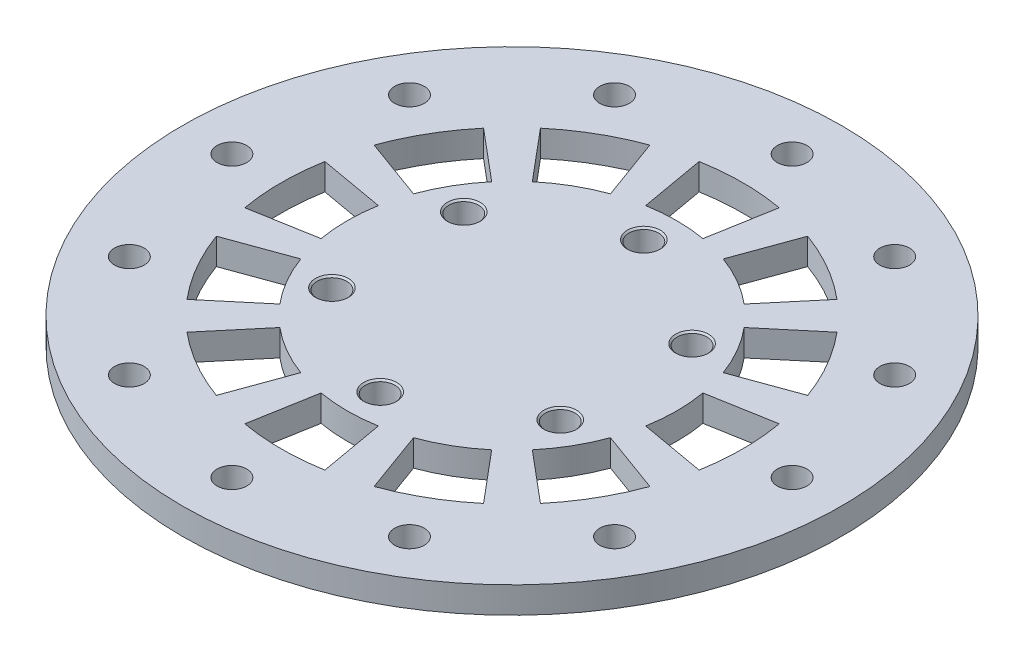
from build123d import *

# Parameters (mm, degrees)
SKETCH_1_R                  = 50
EXTRUDE_1_DEPTH             = 4
CUT_EXTRUDE_2_DEPTH         = 71.823724839
HOLE_WIZARD_M41_D           = 4.5
HOLE_WIZARD_M41_CSINK_D     = 5
HOLE_WIZARD_M41_CSINK_ANGLE = 90
HOLE_WIZARD_M42_D           = 4.5
HOLE_WIZARD_M42_CSINK_D     = 5
HOLE_WIZARD_M42_CSINK_ANGLE = 90


with BuildPart() as part:
    # Эскиз1 → Бобышка-Вытянуть1 (new body)
    with BuildSketch(Plane(origin=(0, 0, 0), x_dir=(1, 0, 0), z_dir=(0, 1, 0))):
        with Locations(Location((0, 0, 0), (0, 0, 270))):
            Circle(SKETCH_1_R)
    extrude(amount=EXTRUDE_1_DEPTH)

    # Эскиз2 → Вырез-Вытянуть2 (cut, through all)
    with BuildSketch(Plane(origin=(0, 0, 0), x_dir=(1, 0, 0), z_dir=(0, 1, 0))):
        with BuildLine():
            Line((8.550503583, -23.49231552), (11.970705016, -32.889241728))
            ThreePointArc((11.970705016, -32.889241728), (17.5, -30.310889132), (22.497566339, -26.811555509))
            Line((22.497566339, -26.811555509), (16.069690242, -19.151111078))
            ThreePointArc((16.069690242, -19.151111078), (12.5, -21.650635095), (8.550503583, -23.49231552))
        make_face()
        with BuildLine():
            Line((-4.341204442, -24.620193825), (-6.077686218, -34.468271355))
            ThreePointArc((-6.077686218, -34.468271355), (0, -35), (6.077686218, -34.468271355))
            Line((6.077686218, -34.468271355), (4.341204442, -24.620193825))
            ThreePointArc((4.341204442, -24.620193825), (0, -25), (-4.341204442, -24.620193825))
        make_face()
        with BuildLine():
            Line((23.49231552, 8.550503583), (32.889241728, 11.970705016))
            ThreePointArc((32.889241728, 11.970705016), (30.310889132, 17.5), (26.811555509, 22.497566339))
            Line((26.811555509, 22.497566339), (19.151111078, 16.069690242))
            ThreePointArc((19.151111078, 16.069690242), (21.650635095, 12.5), (23.49231552, 8.550503583))
        make_face()
        with BuildLine():
            Line((24.620193825, -4.341204442), (34.468271355, -6.077686218))
            ThreePointArc((34.468271355, -6.077686218), (35, 0), (34.468271355, 6.077686218))
            Line((34.468271355, 6.077686218), (24.620193825, 4.341204442))
            ThreePointArc((24.620193825, 4.341204442), (25, 0), (24.620193825, -4.341204442))
        make_face()
        with BuildLine():
            Line((19.151111078, -16.069690242), (26.811555509, -22.497566339))
            ThreePointArc((26.811555509, -22.497566339), (30.310889132, -17.5), (32.889241728, -11.970705016))
            Line((32.889241728, -11.970705016), (23.49231552, -8.550503583))
            ThreePointArc((23.49231552, -8.550503583), (21.650635095, -12.5), (19.151111078, -16.069690242))
        make_face()
        with BuildLine():
            Line((-8.550503583, 23.49231552), (-11.970705016, 32.889241728))
            ThreePointArc((-11.970705016, 32.889241728), (-17.5, 30.310889132), (-22.497566339, 26.811555509))
            Line((-22.497566339, 26.811555509), (-16.069690242, 19.151111078))
            ThreePointArc((-16.069690242, 19.151111078), (-12.5, 21.650635095), (-8.550503583, 23.49231552))
        make_face()
        with BuildLine():
            Line((4.341204442, 24.620193825), (6.077686218, 34.468271355))
            ThreePointArc((6.077686218, 34.468271355), (0, 35), (-6.077686218, 34.468271355))
            Line((-6.077686218, 34.468271355), (-4.341204442, 24.620193825))
            ThreePointArc((-4.341204442, 24.620193825), (0, 25), (4.341204442, 24.620193825))
        make_face()
        with BuildLine():
            Line((16.069690242, 19.151111078), (22.497566339, 26.811555509))
            ThreePointArc((22.497566339, 26.811555509), (17.5, 30.310889132), (11.970705016, 32.889241728))
            Line((11.970705016, 32.889241728), (8.550503583, 23.49231552))
            ThreePointArc((8.550503583, 23.49231552), (12.5, 21.650635095), (16.069690242, 19.151111078))
        make_face()
        with BuildLine():
            Line((-16.069690242, -19.151111078), (-22.497566339, -26.811555509))
            ThreePointArc((-22.497566339, -26.811555509), (-17.5, -30.310889132), (-11.970705016, -32.889241728))
            Line((-11.970705016, -32.889241728), (-8.550503583, -23.49231552))
            ThreePointArc((-8.550503583, -23.49231552), (-12.5, -21.650635095), (-16.069690242, -19.151111078))
        make_face()
        with BuildLine():
            Line((-23.49231552, -8.550503583), (-32.889241728, -11.970705016))
            ThreePointArc((-32.889241728, -11.970705016), (-30.310889132, -17.5), (-26.811555509, -22.497566339))
            Line((-26.811555509, -22.497566339), (-19.151111078, -16.069690242))
            ThreePointArc((-19.151111078, -16.069690242), (-21.650635095, -12.5), (-23.49231552, -8.550503583))
        make_face()
        with BuildLine():
            Line((-24.620193825, 4.341204442), (-34.468271355, 6.077686218))
            ThreePointArc((-34.468271355, 6.077686218), (-35, 0), (-34.468271355, -6.077686218))
            Line((-34.468271355, -6.077686218), (-24.620193825, -4.341204442))
            ThreePointArc((-24.620193825, -4.341204442), (-25, 0), (-24.620193825, 4.341204442))
        make_face()
        with BuildLine():
            Line((-19.151111078, 16.069690242), (-26.811555509, 22.497566339))
            ThreePointArc((-26.811555509, 22.497566339), (-30.310889132, 17.5), (-32.889241728, 11.970705016))
            Line((-32.889241728, 11.970705016), (-23.49231552, 8.550503583))
            ThreePointArc((-23.49231552, 8.550503583), (-21.650635095, 12.5), (-19.151111078, 16.069690242))
        make_face()
    extrude(amount=CUT_EXTRUDE_2_DEPTH, mode=Mode.SUBTRACT)

    # Отверстие с зазором M41 (through all)
    with Locations(Plane(origin=(0, 0, 0), x_dir=(-1, 0, 0), z_dir=(0, -1, 0))):
        with Locations((0, 42.5), (21.25, 36.806079661), (36.806079661, 21.25), (42.5, 0), (36.806079661, -21.25), (21.25, -36.806079661), (0, -42.5), (-21.25, -36.806079661), (-36.806079661, -21.25), (-42.5, 0), (-36.806079661, 21.25), (-21.25, 36.806079661)):
            CounterSinkHole(HOLE_WIZARD_M41_D / 2, HOLE_WIZARD_M41_CSINK_D / 2, counter_sink_angle=HOLE_WIZARD_M41_CSINK_ANGLE)

    # Отверстие с зазором M42 (through all)
    with Locations(Plane(origin=(0, 4, 0), x_dir=(1, 0, 0), z_dir=(0, 1, 0))):
        with Locations((-17.320508076, 10), (0, 20), (17.320508076, 10), (17.320508076, -10), (0, -20), (-17.320508076, -10)):
            CounterSinkHole(HOLE_WIZARD_M42_D / 2, HOLE_WIZARD_M42_CSINK_D / 2, counter_sink_angle=HOLE_WIZARD_M42_CSINK_ANGLE)


solid = part.part
